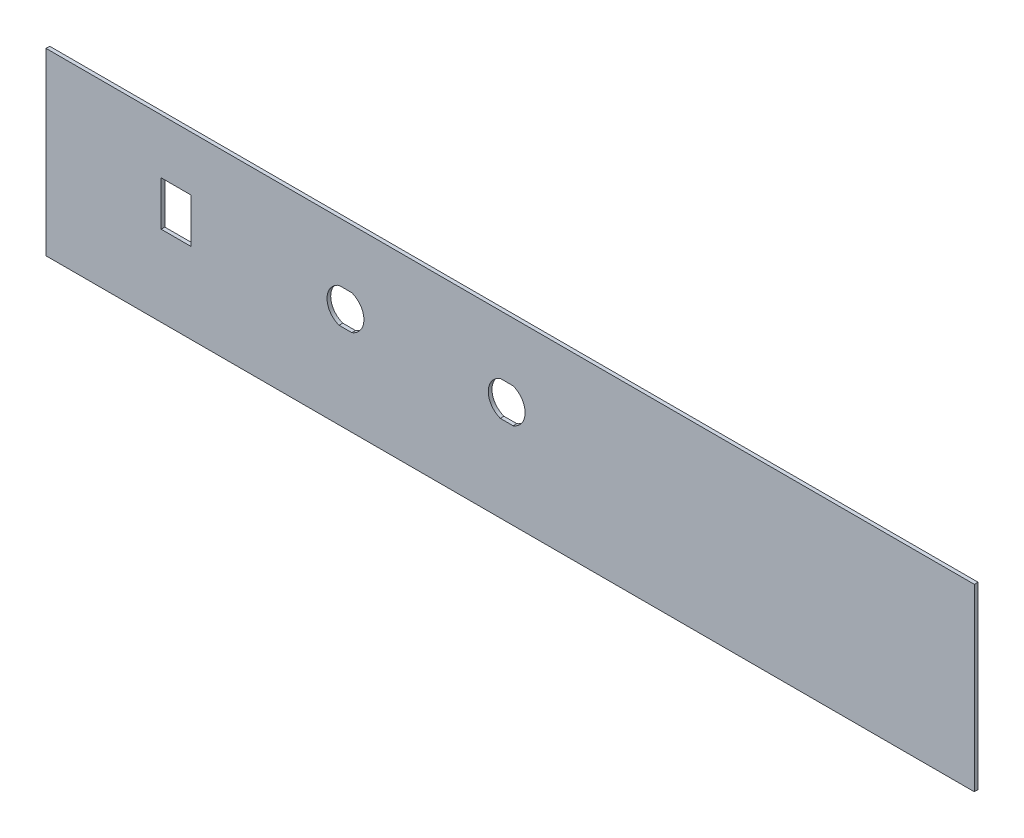
from build123d import *

# Parameters (mm, degrees)
PANEL_W             = 403
PANEL_H             = 78
BOSS_EXTRUDE1_DEPTH = 1.6
ROCKER_SWITCH_W     = 12.9
ROCKER_SWITCH_H     = 19.33
CUT_EXTRUDE2_DEPTH  = 10
CUT_EXTRUDE4_DEPTH  = 10
CUT_EXTRUDE6_DEPTH  = 10


with BuildPart() as part:
    # Panel → Boss-Extrude1 (new body)
    with BuildSketch(Plane.XY):
        with Locations((201.5, 39)):
            Rectangle(PANEL_W, PANEL_H)
    extrude(amount=BOSS_EXTRUDE1_DEPTH)

    # Rocker_Switch → Cut-Extrude2 (cut)
    with BuildSketch(Plane.XY.offset(1.6)):
        with Locations((56.45, 44.665)):
            Rectangle(ROCKER_SWITCH_W, ROCKER_SWITCH_H)
    extrude(amount=-CUT_EXTRUDE2_DEPTH, mode=Mode.SUBTRACT)

    # Turbo → Cut-Extrude4 (cut)
    with BuildSketch(Plane.XY):
        with BuildLine():
            Line((197.216263462, 52.500054059), (202.783736538, 52.500054059))
            ThreePointArc((202.783736538, 52.500054059), (208, 45), (202.783736538, 37.499945941))
            Line((202.783736538, 37.499945941), (197.216263462, 37.499945941))
            ThreePointArc((197.216263462, 37.499945941), (192, 45), (197.216263462, 52.500054059))
        make_face()
    extrude(amount=CUT_EXTRUDE4_DEPTH, mode=Mode.SUBTRACT)

    # En/Disable → Cut-Extrude6 (cut)
    with BuildSketch(Plane.XY.offset(1.6)):
        with BuildLine():
            Line((127.216263462, 52.500054059), (132.783736538, 52.500054059))
            ThreePointArc((132.783736538, 52.500054059), (138, 45), (132.783736538, 37.499945941))
            Line((132.783736538, 37.499945941), (127.216263462, 37.499945941))
            ThreePointArc((127.216263462, 37.499945941), (122, 45), (127.216263462, 52.500054059))
        make_face()
    extrude(amount=-CUT_EXTRUDE6_DEPTH, mode=Mode.SUBTRACT)


solid = part.part
